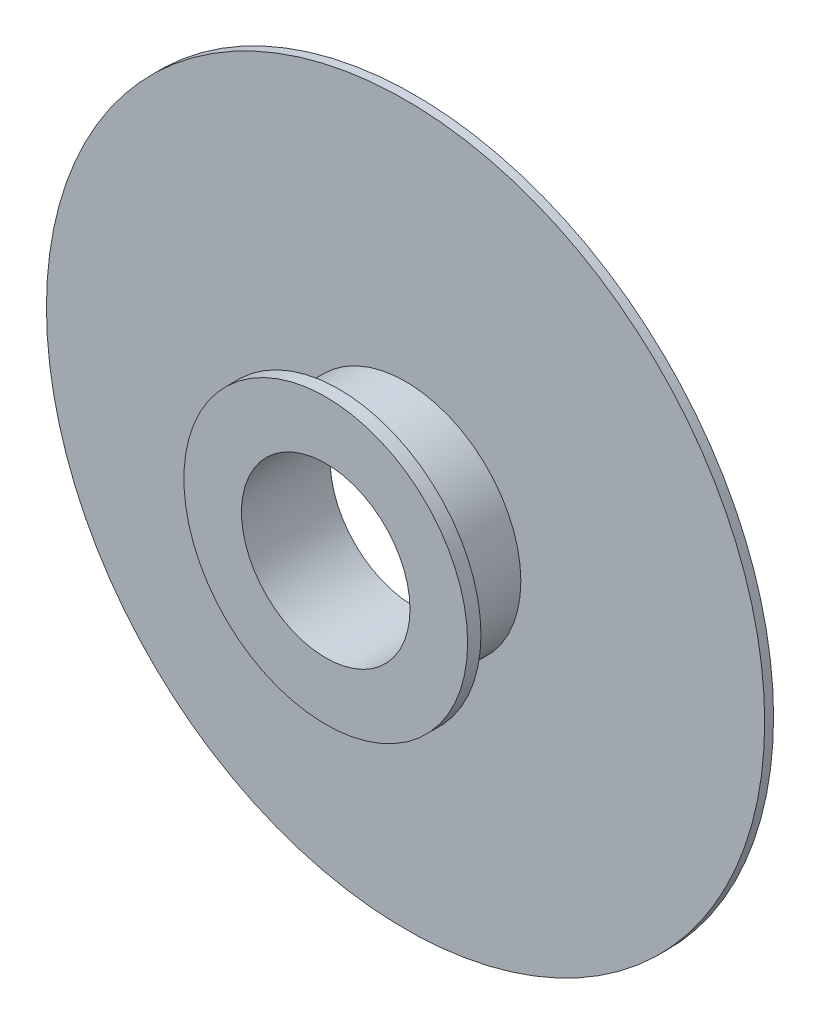
from build123d import *

# Parameters (mm, degrees)
SKETCH1_R           = 81
SKETCH1_R_2         = 19
BOSS_EXTRUDE1_DEPTH = 2
SKETCH2_R           = 26
SKETCH2_R_2         = 19
BOSS_EXTRUDE2_DEPTH = 18
BOSS_EXTRUDE3_START = -3
SKETCH3_R           = 32
SKETCH3_R_2         = 26
BOSS_EXTRUDE3_DEPTH = 3


with BuildPart() as part:
    # Sketch1 → Boss-Extrude1 (new body)
    with BuildSketch(Plane.XY):
        Circle(SKETCH1_R)
        Circle(SKETCH1_R_2, mode=Mode.SUBTRACT)
    extrude(amount=BOSS_EXTRUDE1_DEPTH)

    # Sketch2 → Boss-Extrude2 (add)
    with BuildSketch(Plane.XY.offset(2)):
        Circle(SKETCH2_R)
        Circle(SKETCH2_R_2, mode=Mode.SUBTRACT)
    extrude(amount=BOSS_EXTRUDE2_DEPTH)

    # Sketch3 → Boss-Extrude3 (add)
    with BuildSketch(Plane.XY.offset(20).offset(BOSS_EXTRUDE3_START)):
        Circle(SKETCH3_R)
        Circle(SKETCH3_R_2, mode=Mode.SUBTRACT)
    extrude(amount=BOSS_EXTRUDE3_DEPTH)


solid = part.part
